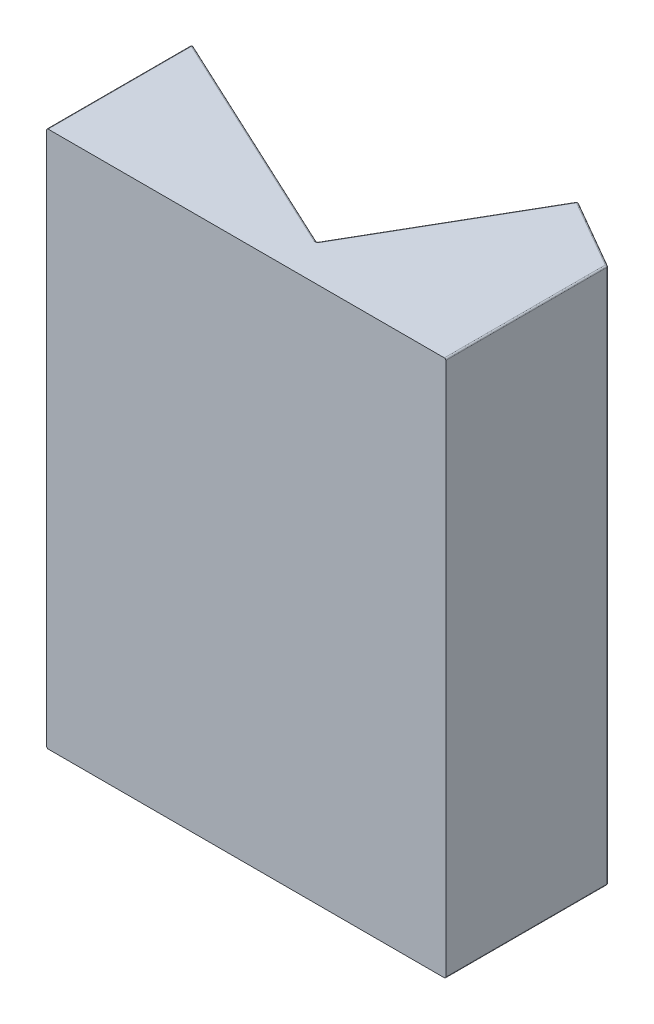
from build123d import *

# Parameters (mm, degrees)
BOSS_EXTRUDE1_DEPTH = 73
FILLET1_R           = 0.2


with BuildPart() as part:
    # Sketch1 → Boss-Extrude1 (new body)
    with BuildSketch(Plane(origin=(0, 0, 0), x_dir=(1, 0, 0), z_dir=(0, 1, 0))):
        Polygon((0, 0), (54.275908818, 0), (54.275908818, 22), (44.720772546, 27.516660498), (31.720772546, 5), (0, 19.791639161), align=None)
    extrude(amount=BOSS_EXTRUDE1_DEPTH)

    # Fillet1
    fillet1_edges = [part.edges().sort_by_distance(p)[0] for p in [
        (31.720772546, 36.5, -5),
        (44.720772546, 36.5, -27.516660498),
        (54.275908818, 36.5, -22),
        (0, 36.5, -19.791639161),
        (54.275908818, 73, -11),
        (49.498340682, 73, -24.758330249),
        (38.220772546, 73, -16.258330249),
        (15.860386273, 73, -12.39581958),
        (38.220772546, 0, -16.258330249),
        (49.498340682, 0, -24.758330249),
        (54.275908818, 0, -11),
        (0, 73, -9.89581958),
        (0, 0, -9.89581958),
        (15.860386273, 0, -12.39581958),
    ]]
    fillet(fillet1_edges, radius=FILLET1_R)


solid = part.part
